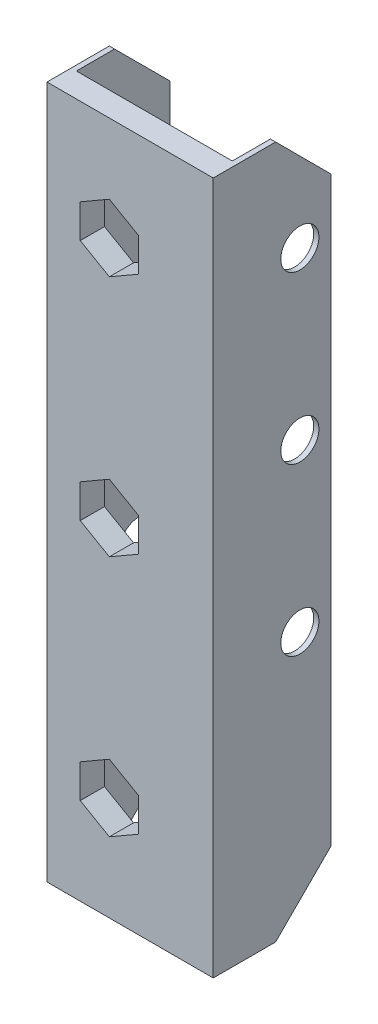
from build123d import *

# Parameters (mm, degrees)
BOSS_EXTRUDE1_DEPTH     = 100
CUT_EXTRUDE1_DEPTH      = 105.235310716
CUT_EXTRUDE1_DEPTH_BACK = 105.235310716
M5_CLEARANCE_HOLE1_D    = 5.5
CHAMFER1_SIZE           = 8


with BuildPart() as part:
    # Sketch1 → Boss-Extrude1 (new body)
    with BuildSketch(Plane(origin=(0, 0, 0), x_dir=(1, 0, 0), z_dir=(0, 1, 0))):
        Polygon((0, 0), (0, 17), (0.75, 17), (0.75, 3.5), (23.25, 3.5), (23.25, 17), (24, 17), (24, 0), align=None)
    extrude(amount=BOSS_EXTRUDE1_DEPTH)

    # Sketch2 → Cut-Extrude1 (cut, two sides: drawn at the far end of the back side and taken through both)
    with BuildSketch(Plane.XY.offset(-CUT_EXTRUDE1_DEPTH_BACK)):
        Polygon((4.8, 52.424871131), (4.8, 47.575128869), (9, 45.150257739), (13.2, 47.575128869), (13.2, 52.424871131), (9, 54.849742261), align=None)
        Polygon((13.2, 12.575128869), (13.2, 17.424871131), (9, 19.849742261), (4.8, 17.424871131), (4.8, 12.575128869), (9, 10.150257739), align=None)
        Polygon((4.8, 87.424871131), (4.8, 82.575128869), (9, 80.150257739), (13.2, 82.575128869), (13.2, 87.424871131), (9, 89.849742261), align=None)
    extrude(amount=CUT_EXTRUDE1_DEPTH + CUT_EXTRUDE1_DEPTH_BACK, mode=Mode.SUBTRACT)

    # M5 Clearance Hole1 (through all)
    with Locations(Plane(origin=(24, 0, 0), x_dir=(0, 0, -1), z_dir=(1, 0, 0))):
        with Locations((12.5, 85), (12.5, 37), (12.5, 61)):
            Hole(M5_CLEARANCE_HOLE1_D / 2)

    # Chamfer1
    chamfer1_edges = [part.edges().sort_by_distance(p)[0] for p in [
        (23.625, 0, -17),
        (23.625, 100, -17),
        (0.375, 100, -17),
        (0.375, 0, -17),
    ]]
    chamfer(chamfer1_edges, length=CHAMFER1_SIZE)


solid = part.part
